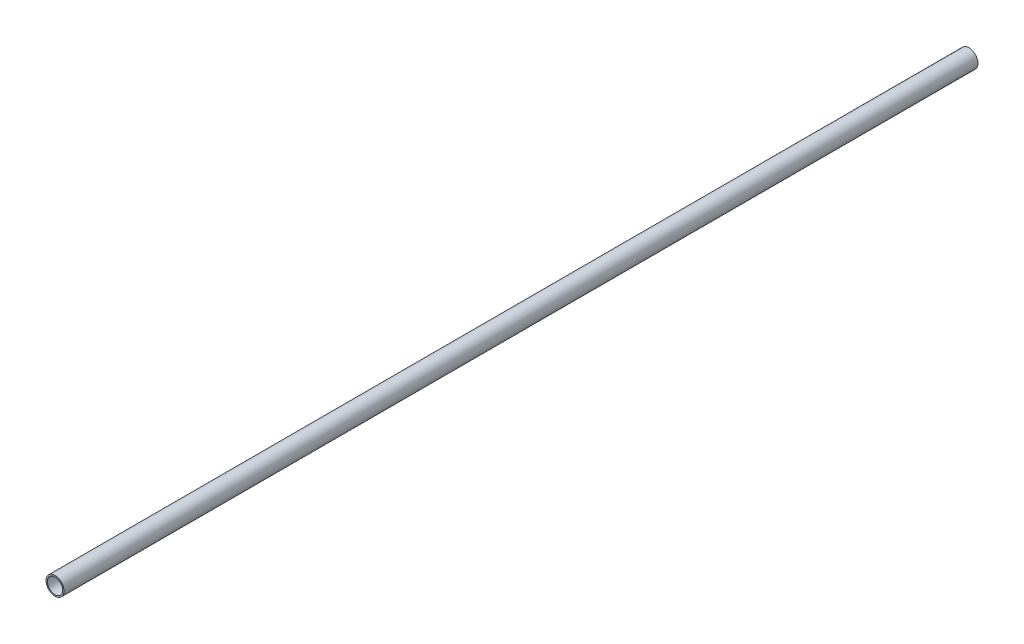
from build123d import *

# Parameters (mm, degrees)
SKETCH1_R           = 7.9
SKETCH1_R_2         = 6.7
BOSS_EXTRUDE1_DEPTH = 800


with BuildPart() as part:
    # Sketch1 → Boss-Extrude1 (new body)
    with BuildSketch(Plane.XY):
        Circle(SKETCH1_R)
        Circle(SKETCH1_R_2, mode=Mode.SUBTRACT)
    extrude(amount=BOSS_EXTRUDE1_DEPTH)


solid = part.part
